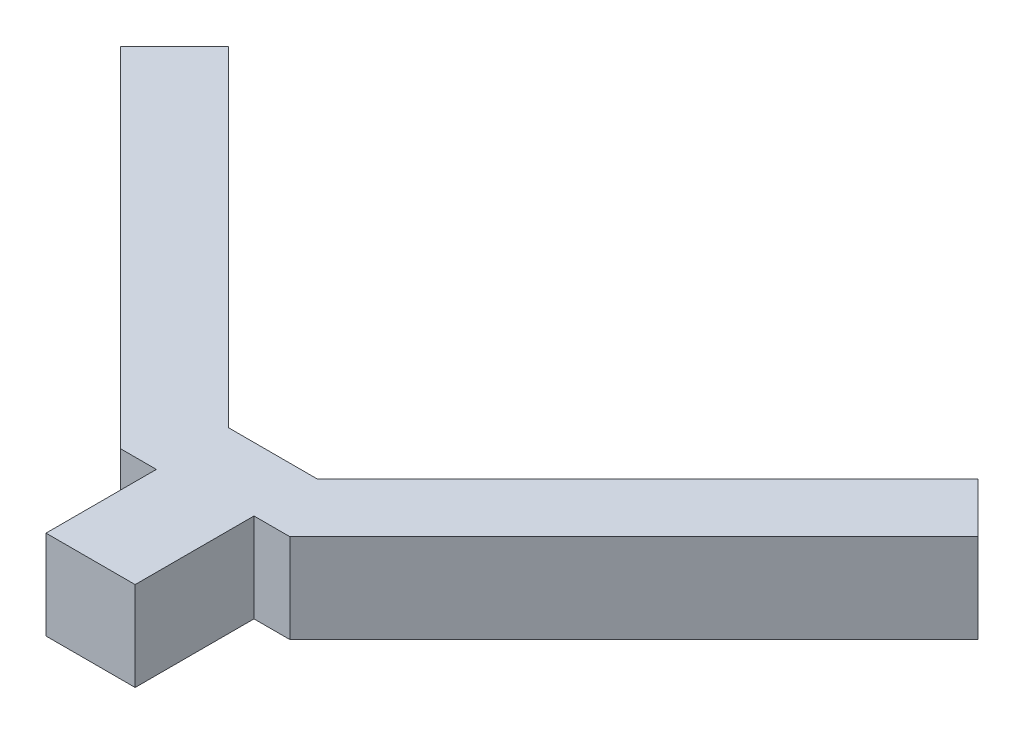
from build123d import *

# Parameters (mm, degrees)
EXTRUDE_1_DEPTH = 2.1


with BuildPart() as part:
    # 草图1 → 凸台-拉伸1 (new body)
    with BuildSketch(Plane(origin=(0, 0, 0), x_dir=(1, 0, 0), z_dir=(0, 1, 0))):
        Polygon((0.435502757, 2.876832098), (8.21367735, 10.655006691), (9.386469556, 9.482214485), (1.28108717, 1.376832098), (0.435502757, 1.376832098), (0.435502757, -1.423167902), (-1.664497243, -1.423167902), (-1.664497243, 1.176832098), (-2.510081655, 1.176832098), (-10.715464042, 9.382214485), (-9.442671836, 10.655006691), (-1.664497243, 2.876832098), align=None)
    extrude(amount=EXTRUDE_1_DEPTH)


solid = part.part
